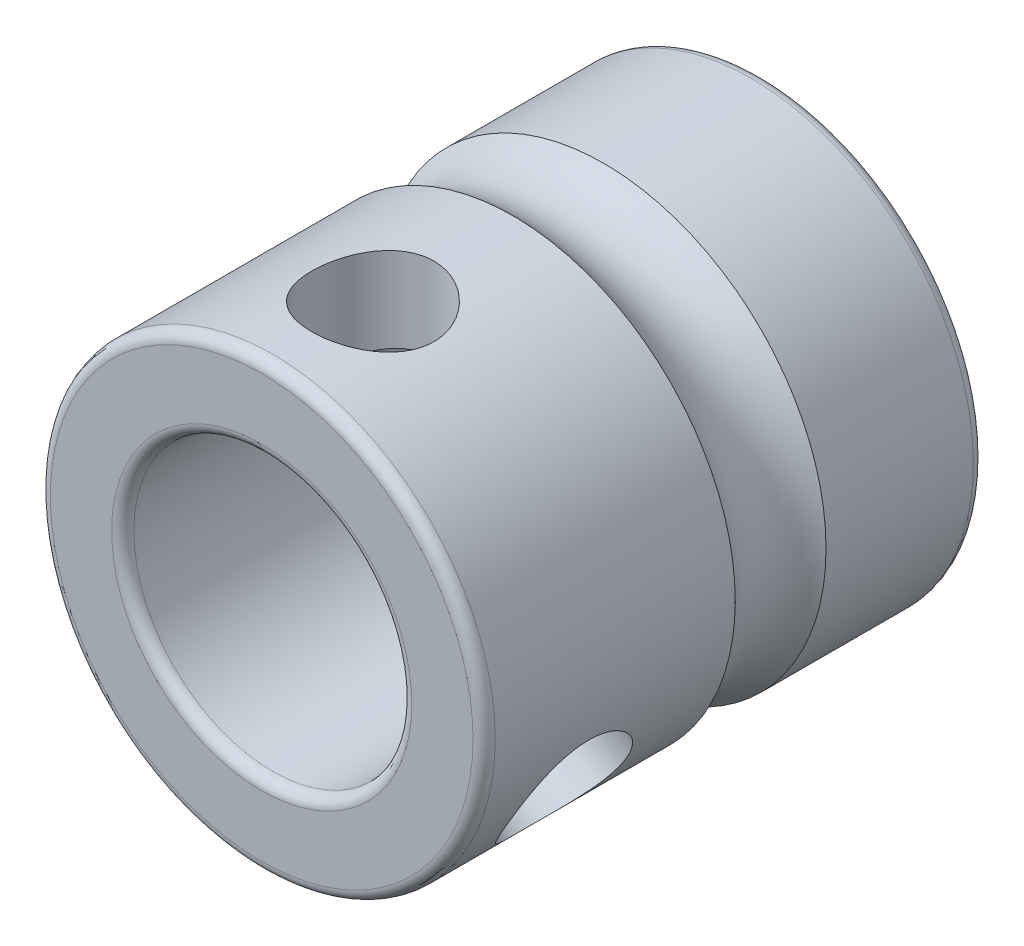
from build123d import *

# Parameters (mm, degrees)
ESQUISSE2_W                  = 3.3
ESQUISSE2_H                  = 16.393670871
R_P_TITION_CIRCULAIRE1_COUNT = 2
R_P_TITION_CIRCULAIRE1_ANGLE = 120


with BuildPart() as part:
    # Esquisse1 → Révolution1 (revolve)
    with BuildSketch(Plane(origin=(0, 0, 0), x_dir=(0, 0, -1), z_dir=(1, 0, 0)), mode=Mode.PRIVATE) as r_volution1_sk:
        with BuildLine():
            Line((2.449489743, 12), (10.4, 12))
            ThreePointArc((10.4, 12), (10.824264069, 11.824264069), (11, 11.4))
            Line((11, 11.4), (11, 8.1))
            ThreePointArc((11, 8.1), (10.824264069, 7.675735931), (10.4, 7.5))
            Line((10.4, 7.5), (-15.4, 7.5))
            ThreePointArc((-15.4, 7.5), (-15.824264069, 7.675735931), (-16, 8.1))
            Line((-16, 8.1), (-16, 11.4))
            ThreePointArc((-16, 11.4), (-15.824264069, 11.824264069), (-15.4, 12))
            Line((-15.4, 12), (-2.449489743, 12))
            ThreePointArc((-2.449489743, 12), (0, 11), (2.449489743, 12))
        make_face()
    revolve(r_volution1_sk.sketch.rotate(Axis((0, 0, 2.449489743), (0, 0, -1)), 90), axis=Axis((0, 0, 2.449489743), (0, 0, -1)))

    # Esquisse2 → Dégagement M61 (revolve, cut)
    with BuildSketch(Plane(origin=(0, 0, 10), x_dir=(0, 0, -1), z_dir=(1, 0, 0))):
        with Locations((1.65, 8.196835436)):
            Rectangle(ESQUISSE2_W, ESQUISSE2_H)
    d_gagement_m61 = revolve(axis=Axis((0, -6.35, 10), (0, 1, 0)), mode=Mode.SUBTRACT)

    # Répétition circulaire1: Dégagement M61 ×2 about axis
    r_p_tition_circulaire1_axis = Axis((0, 0, 2.449489743), (0, 0, -1))
    for i in range(1, R_P_TITION_CIRCULAIRE1_COUNT):
        add(d_gagement_m61.rotate(r_p_tition_circulaire1_axis, i * R_P_TITION_CIRCULAIRE1_ANGLE / (R_P_TITION_CIRCULAIRE1_COUNT - 1)), mode=Mode.SUBTRACT)


solid = part.part
